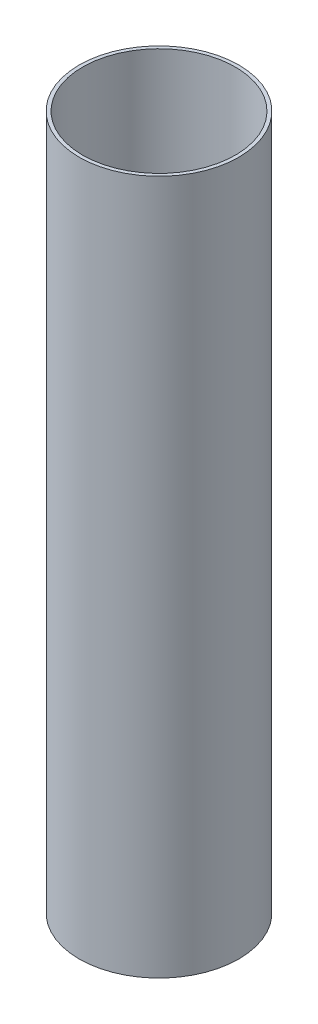
from build123d import *

# Parameters (mm, degrees)
SKETCH1_R           = 115
SKETCH1_R_2         = 110
EXTRUDE_THIN1_DEPTH = 1000


with BuildPart() as part:
    # Sketch1 → Extrude-Thin1 (new body)
    with BuildSketch(Plane(origin=(0, 0, 0), x_dir=(1, 0, 0), z_dir=(0, 1, 0))):
        Circle(SKETCH1_R)
        Circle(SKETCH1_R_2, mode=Mode.SUBTRACT)
    extrude(amount=EXTRUDE_THIN1_DEPTH)


solid = part.part
